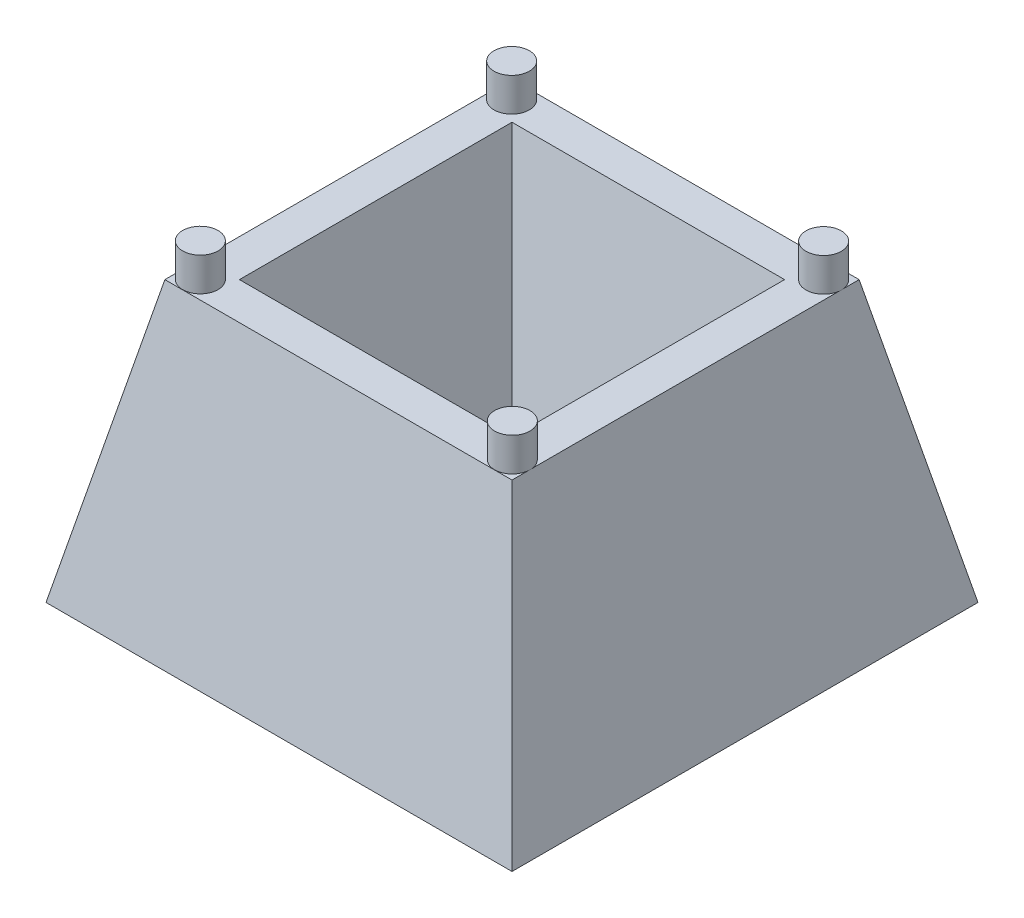
from build123d import *

# Parameters (mm, degrees)
SKETCH1_W                = 25
SKETCH1_H                = 25
BOSS_EXTRUDE1_DEPTH      = 15
BOSS_EXTRUDE1_TAPER      = 12
SKETCH2_R                = 0.95
PEGS_DEPTH               = 1.8
SKETCH3_W                = 14.62330315
SKETCH3_H                = 14.62330315
RESERBOIR_DEPTH          = 12
RESERBOIR_DRAFT          = -12
SKETCH5_R                = 0.75
PILLARS_DEPTH            = 1.5
PILLARS_DRAFT            = 12
PILLARS_PROFILE_2_DEPTH  = 1.5
PILLARS_PROFILE_2_DRAFT  = 12
PILLARS_PROFILE_3_DEPTH  = 1.5
PILLARS_PROFILE_3_DRAFT  = 12
PILLARS_PROFILE_4_DEPTH  = 1.5
PILLARS_PROFILE_4_DRAFT  = 12
PILLARS_PROFILE_5_DEPTH  = 1.5
PILLARS_PROFILE_5_DRAFT  = 12
PILLARS_PROFILE_6_DEPTH  = 1.5
PILLARS_PROFILE_6_DRAFT  = 12
PILLARS_PROFILE_7_DEPTH  = 1.5
PILLARS_PROFILE_7_DRAFT  = 12
PILLARS_PROFILE_8_DEPTH  = 1.5
PILLARS_PROFILE_8_DRAFT  = 12
PILLARS_PROFILE_9_DEPTH  = 1.5
PILLARS_PROFILE_9_DRAFT  = 12
PILLARS_PROFILE_10_DEPTH = 1.5
PILLARS_PROFILE_10_DRAFT = 12
BOSS_EXTRUDE2_DEPTH      = 0.5


with BuildPart() as part:
    # Sketch1 → Boss-Extrude1 (new body)
    with BuildSketch(Plane(origin=(0, 0, 0), x_dir=(1, 0, 0), z_dir=(0, 1, 0))):
        Rectangle(SKETCH1_W, SKETCH1_H)
    extrude(amount=BOSS_EXTRUDE1_DEPTH, taper=BOSS_EXTRUDE1_TAPER)

    # Sketch2 → Pegs (add)
    with BuildSketch(Plane(origin=(0, 15, 0), x_dir=(1, 0, 0), z_dir=(0, 1, 0))):
        with Locations(Location((-8.368372438, 8.351432413, 0), (0, 0, 173.18062265))):
            Circle(SKETCH2_R)
        with Locations(Location((-8.368372438, -8.351432413, 0), (0, 0, 173.18062265))):
            Circle(SKETCH2_R)
        with Locations(Location((8.368372438, 8.351432413, 0), (0, 0, 6.81937735))):
            Circle(SKETCH2_R)
        with Locations(Location((8.368372438, -8.351432413, 0), (0, 0, 6.81937735))):
            Circle(SKETCH2_R)
    extrude(amount=PEGS_DEPTH)


with BuildPart() as reserboir_tool:
    # Sketch3 → Reserboir (with draft: the straight prism first)
    with BuildSketch(Plane(origin=(0, 15, 0), x_dir=(1, 0, 0), z_dir=(0, 1, 0))):
        Rectangle(SKETCH3_W, SKETCH3_H)
    extrude(amount=-RESERBOIR_DEPTH)
    # Reserboir: the draft: its side faces are tilted about the plane it starts from
    reserboir_sides = [reserboir_tool.faces().sort_by_distance(p)[0] for p in [
        (0, 9, 7.311651575),
        (7.311651575, 9, 0),
        (0, 9, -7.311651575),
        (-7.311651575, 9, 0),
    ]]
    draft(reserboir_sides, Plane(origin=(0, 15, 0), x_dir=(1, 0, 0), z_dir=(0, 1, 0)), RESERBOIR_DRAFT)


with BuildPart() as part_1:
    add(part.part)

    # Reserboir: cut by reserboir_tool
    add(reserboir_tool.part, mode=Mode.SUBTRACT)


with BuildPart() as pillars_tool:
    # Sketch5 → Pillars (with draft: the straight prism first)
    with BuildSketch(Plane(origin=(0, 3, 0), x_dir=(1, 0, 0), z_dir=(0, 1, 0))):
        with Locations((-1.515979808, 2.025)):
            Circle(SKETCH5_R)
    extrude(amount=PILLARS_DEPTH)
    # Pillars: the draft: its side faces are tilted about the plane it starts from
    pillars_sides = [pillars_tool.faces().sort_by_distance(p)[0] for p in [
        (-2.265979808, 3.75, -2.025),
    ]]
    draft(pillars_sides, Plane(origin=(0, 3, 0), x_dir=(1, 0, 0), z_dir=(0, 1, 0)), PILLARS_DRAFT)


with BuildPart() as part_2:
    add(part_1.part)

    # Pillars: add pillars_tool
    add(pillars_tool.part)


with BuildPart() as pillars_profile_2_tool:
    # Sketch5 → Pillars profile 2 (with draft: the straight prism first)
    with BuildSketch(Plane(origin=(0, 3, 0), x_dir=(1, 0, 0), z_dir=(0, 1, 0))):
        with Locations((-3.515979808, 2)):
            Circle(SKETCH5_R)
    extrude(amount=PILLARS_PROFILE_2_DEPTH)
    # Pillars profile 2: the draft: its side faces are tilted about the plane it starts from
    pillars_profile_2_sides = [pillars_profile_2_tool.faces().sort_by_distance(p)[0] for p in [
        (-4.265979808, 3.75, -2),
    ]]
    draft(pillars_profile_2_sides, Plane(origin=(0, 3, 0), x_dir=(1, 0, 0), z_dir=(0, 1, 0)), PILLARS_PROFILE_2_DRAFT)


with BuildPart() as part_3:
    add(part_2.part)

    # Pillars profile 2: add pillars_profile_2_tool
    add(pillars_profile_2_tool.part)


with BuildPart() as pillars_profile_3_tool:
    # Sketch5 → Pillars profile 3 (with draft: the straight prism first)
    with BuildSketch(Plane(origin=(0, 3, 0), x_dir=(1, 0, 0), z_dir=(0, 1, 0))):
        with Locations((-3.515979808, -2)):
            Circle(SKETCH5_R)
    extrude(amount=PILLARS_PROFILE_3_DEPTH)
    # Pillars profile 3: the draft: its side faces are tilted about the plane it starts from
    pillars_profile_3_sides = [pillars_profile_3_tool.faces().sort_by_distance(p)[0] for p in [
        (-4.265979808, 3.75, 2),
    ]]
    draft(pillars_profile_3_sides, Plane(origin=(0, 3, 0), x_dir=(1, 0, 0), z_dir=(0, 1, 0)), PILLARS_PROFILE_3_DRAFT)


with BuildPart() as part_4:
    add(part_3.part)

    # Pillars profile 3: add pillars_profile_3_tool
    add(pillars_profile_3_tool.part)


with BuildPart() as pillars_profile_4_tool:
    # Sketch5 → Pillars profile 4 (with draft: the straight prism first)
    with BuildSketch(Plane(origin=(0, 3, 0), x_dir=(1, 0, 0), z_dir=(0, 1, 0))):
        with Locations((-1.515979808, -2)):
            Circle(SKETCH5_R)
    extrude(amount=PILLARS_PROFILE_4_DEPTH)
    # Pillars profile 4: the draft: its side faces are tilted about the plane it starts from
    pillars_profile_4_sides = [pillars_profile_4_tool.faces().sort_by_distance(p)[0] for p in [
        (-2.265979808, 3.75, 2),
    ]]
    draft(pillars_profile_4_sides, Plane(origin=(0, 3, 0), x_dir=(1, 0, 0), z_dir=(0, 1, 0)), PILLARS_PROFILE_4_DRAFT)


with BuildPart() as part_5:
    add(part_4.part)

    # Pillars profile 4: add pillars_profile_4_tool
    add(pillars_profile_4_tool.part)


with BuildPart() as pillars_profile_5_tool:
    # Sketch5 → Pillars profile 5 (with draft: the straight prism first)
    with BuildSketch(Plane(origin=(0, 3, 0), x_dir=(1, 0, 0), z_dir=(0, 1, 0))):
        with Locations((1.5, 2)):
            Circle(SKETCH5_R)
    extrude(amount=PILLARS_PROFILE_5_DEPTH)
    # Pillars profile 5: the draft: its side faces are tilted about the plane it starts from
    pillars_profile_5_sides = [pillars_profile_5_tool.faces().sort_by_distance(p)[0] for p in [
        (0.75, 3.75, -2),
    ]]
    draft(pillars_profile_5_sides, Plane(origin=(0, 3, 0), x_dir=(1, 0, 0), z_dir=(0, 1, 0)), PILLARS_PROFILE_5_DRAFT)


with BuildPart() as part_6:
    add(part_5.part)

    # Pillars profile 5: add pillars_profile_5_tool
    add(pillars_profile_5_tool.part)


with BuildPart() as pillars_profile_6_tool:
    # Sketch5 → Pillars profile 6 (with draft: the straight prism first)
    with BuildSketch(Plane(origin=(0, 3, 0), x_dir=(1, 0, 0), z_dir=(0, 1, 0))):
        with Locations((3.5, 2)):
            Circle(SKETCH5_R)
    extrude(amount=PILLARS_PROFILE_6_DEPTH)
    # Pillars profile 6: the draft: its side faces are tilted about the plane it starts from
    pillars_profile_6_sides = [pillars_profile_6_tool.faces().sort_by_distance(p)[0] for p in [
        (2.75, 3.75, -2),
    ]]
    draft(pillars_profile_6_sides, Plane(origin=(0, 3, 0), x_dir=(1, 0, 0), z_dir=(0, 1, 0)), PILLARS_PROFILE_6_DRAFT)


with BuildPart() as part_7:
    add(part_6.part)

    # Pillars profile 6: add pillars_profile_6_tool
    add(pillars_profile_6_tool.part)


with BuildPart() as pillars_profile_7_tool:
    # Sketch5 → Pillars profile 7 (with draft: the straight prism first)
    with BuildSketch(Plane(origin=(0, 3, 0), x_dir=(1, 0, 0), z_dir=(0, 1, 0))):
        with Locations((3.5, -2)):
            Circle(SKETCH5_R)
    extrude(amount=PILLARS_PROFILE_7_DEPTH)
    # Pillars profile 7: the draft: its side faces are tilted about the plane it starts from
    pillars_profile_7_sides = [pillars_profile_7_tool.faces().sort_by_distance(p)[0] for p in [
        (2.75, 3.75, 2),
    ]]
    draft(pillars_profile_7_sides, Plane(origin=(0, 3, 0), x_dir=(1, 0, 0), z_dir=(0, 1, 0)), PILLARS_PROFILE_7_DRAFT)


with BuildPart() as part_8:
    add(part_7.part)

    # Pillars profile 7: add pillars_profile_7_tool
    add(pillars_profile_7_tool.part)


with BuildPart() as pillars_profile_8_tool:
    # Sketch5 → Pillars profile 8 (with draft: the straight prism first)
    with BuildSketch(Plane(origin=(0, 3, 0), x_dir=(1, 0, 0), z_dir=(0, 1, 0))):
        with Locations((1.5, -2)):
            Circle(SKETCH5_R)
    extrude(amount=PILLARS_PROFILE_8_DEPTH)
    # Pillars profile 8: the draft: its side faces are tilted about the plane it starts from
    pillars_profile_8_sides = [pillars_profile_8_tool.faces().sort_by_distance(p)[0] for p in [
        (0.75, 3.75, 2),
    ]]
    draft(pillars_profile_8_sides, Plane(origin=(0, 3, 0), x_dir=(1, 0, 0), z_dir=(0, 1, 0)), PILLARS_PROFILE_8_DRAFT)


with BuildPart() as part_9:
    add(part_8.part)

    # Pillars profile 8: add pillars_profile_8_tool
    add(pillars_profile_8_tool.part)


with BuildPart() as pillars_profile_9_tool:
    # Sketch5 → Pillars profile 9 (with draft: the straight prism first)
    with BuildSketch(Plane(origin=(0, 3, 0), x_dir=(1, 0, 0), z_dir=(0, 1, 0))):
        with Locations((-4.515979808, 0)):
            Circle(SKETCH5_R)
    extrude(amount=PILLARS_PROFILE_9_DEPTH)
    # Pillars profile 9: the draft: its side faces are tilted about the plane it starts from
    pillars_profile_9_sides = [pillars_profile_9_tool.faces().sort_by_distance(p)[0] for p in [
        (-5.265979808, 3.75, 0),
    ]]
    draft(pillars_profile_9_sides, Plane(origin=(0, 3, 0), x_dir=(1, 0, 0), z_dir=(0, 1, 0)), PILLARS_PROFILE_9_DRAFT)


with BuildPart() as part_10:
    add(part_9.part)

    # Pillars profile 9: add pillars_profile_9_tool
    add(pillars_profile_9_tool.part)


with BuildPart() as pillars_profile_10_tool:
    # Sketch5 → Pillars profile 10 (with draft: the straight prism first)
    with BuildSketch(Plane(origin=(0, 3, 0), x_dir=(1, 0, 0), z_dir=(0, 1, 0))):
        with Locations((4.5, 0)):
            Circle(SKETCH5_R)
    extrude(amount=PILLARS_PROFILE_10_DEPTH)
    # Pillars profile 10: the draft: its side faces are tilted about the plane it starts from
    pillars_profile_10_sides = [pillars_profile_10_tool.faces().sort_by_distance(p)[0] for p in [
        (3.75, 3.75, 0),
    ]]
    draft(pillars_profile_10_sides, Plane(origin=(0, 3, 0), x_dir=(1, 0, 0), z_dir=(0, 1, 0)), PILLARS_PROFILE_10_DRAFT)


with BuildPart() as part_11:
    add(part_10.part)

    # Pillars profile 10: add pillars_profile_10_tool
    add(pillars_profile_10_tool.part)

    # Sketch7 → Boss-Extrude2 (add)
    with BuildSketch(Plane(origin=(0, 3, 0), x_dir=(1, 0, 0), z_dir=(0, 1, 0))):
        Polygon((-1.41, 1.1), (1.41, 1.1), (1.41, 0.438279254), (1.34, 0.37954228), (1.24, 0.37954228), (1.335534595, 0.459705324), (1.290583311, 0.628511972), (1.146110543, 0.594444542), (0.89, 0.37954228), (0.79, 0.37954228), (0.885534595, 0.459705324), (0.840583311, 0.628511972), (0.696110543, 0.594444542), (0.44, 0.37954228), (0.34, 0.37954228), (0.435534595, 0.459705324), (0.390583311, 0.628511972), (0.246110543, 0.594444542), (-0.01, 0.37954228), (-0.11, 0.37954228), (-0.014465405, 0.459705324), (-0.059416689, 0.628511972), (-0.203889457, 0.594444542), (-0.46, 0.37954228), (-0.56, 0.37954228), (-0.464465405, 0.459705324), (-0.509416689, 0.628511972), (-0.653889457, 0.594444542), (-0.91, 0.37954228), (-1.01, 0.37954228), (-0.914465405, 0.459705324), (-0.959416689, 0.628511972), (-1.103889457, 0.594444542), (-1.36, 0.37954228), (-1.41, 0.37954228), align=None)
        Polygon((-1.41, 0.27954228), (-1.36, 0.27954228), (-1.103889457, 0.064640019), (-0.959416689, 0.030572589), (-0.914465405, 0.199379237), (-1.01, 0.27954228), (-0.91, 0.27954228), (-0.653889457, 0.064640019), (-0.509416689, 0.030572589), (-0.464465405, 0.199379237), (-0.56, 0.27954228), (-0.46, 0.27954228), (-0.203889457, 0.064640019), (-0.059416689, 0.030572589), (-0.014465405, 0.199379237), (-0.11, 0.27954228), (-0.01, 0.27954228), (0.246110543, 0.064640019), (0.390583311, 0.030572589), (0.435534595, 0.199379237), (0.34, 0.27954228), (0.44, 0.27954228), (0.696110543, 0.064640019), (0.840583311, 0.030572589), (0.885534595, 0.199379237), (0.79, 0.27954228), (0.89, 0.27954228), (1.146110543, 0.064640019), (1.290583311, 0.030572589), (1.335534595, 0.199379237), (1.24, 0.27954228), (1.34, 0.27954228), (1.41, 0.220805306), (1.41, -0.27954228), (1.36, -0.27954228), (1.103889457, -0.064640019), (0.959416689, -0.030572589), (0.914465405, -0.199379237), (1.01, -0.27954228), (0.91, -0.27954228), (0.653889457, -0.064640019), (0.509416689, -0.030572589), (0.464465405, -0.199379237), (0.56, -0.27954228), (0.46, -0.27954228), (0.203889457, -0.064640019), (0.059416689, -0.030572589), (0.014465405, -0.199379237), (0.11, -0.27954228), (0.01, -0.27954228), (-0.246110543, -0.064640019), (-0.390583311, -0.030572589), (-0.435534595, -0.199379237), (-0.34, -0.27954228), (-0.44, -0.27954228), (-0.696110543, -0.064640019), (-0.840583311, -0.030572589), (-0.885534595, -0.199379237), (-0.79, -0.27954228), (-0.89, -0.27954228), (-1.146110543, -0.064640019), (-1.290583311, -0.030572589), (-1.335534595, -0.199379237), (-1.24, -0.27954228), (-1.34, -0.27954228), (-1.41, -0.220805306), align=None)
        Polygon((-1.41, -1.1), (1.41, -1.1), (1.41, -0.37954228), (1.36, -0.37954228), (1.103889457, -0.594444542), (0.959416689, -0.628511972), (0.914465405, -0.459705324), (1.01, -0.37954228), (0.91, -0.37954228), (0.653889457, -0.594444542), (0.509416689, -0.628511972), (0.464465405, -0.459705324), (0.56, -0.37954228), (0.46, -0.37954228), (0.203889457, -0.594444542), (0.059416689, -0.628511972), (0.014465405, -0.459705324), (0.11, -0.37954228), (0.01, -0.37954228), (-0.246110543, -0.594444542), (-0.390583311, -0.628511972), (-0.435534595, -0.459705324), (-0.34, -0.37954228), (-0.44, -0.37954228), (-0.696110543, -0.594444542), (-0.840583311, -0.628511972), (-0.885534595, -0.459705324), (-0.79, -0.37954228), (-0.89, -0.37954228), (-1.146110543, -0.594444542), (-1.290583311, -0.628511972), (-1.335534595, -0.459705324), (-1.24, -0.37954228), (-1.34, -0.37954228), (-1.41, -0.438279254), align=None)
    extrude(amount=BOSS_EXTRUDE2_DEPTH)


solid = part_11.part
